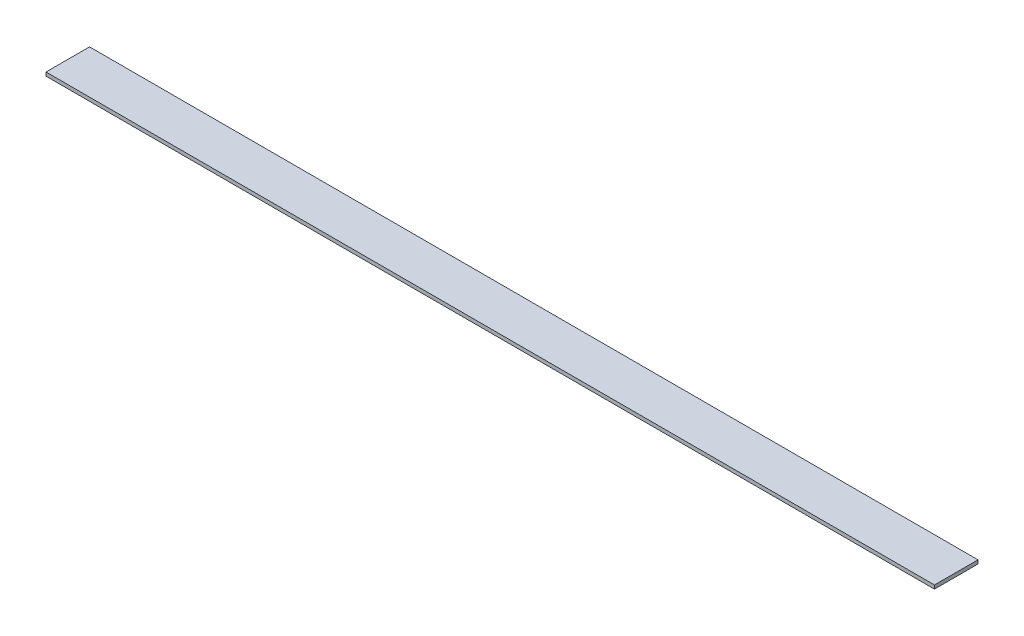
from build123d import *

# Parameters (mm, degrees)
SKETCH1_W               = 930
SKETCH1_H               = 555
SKETCH1_W_2             = 777.6
SKETCH1_H_2             = 478.8
BOSS_EXTRUDE2_DEPTH     = 3.175
CUT_EXTRUDE1_DEPTH      = 542.517618019
CUT_EXTRUDE1_DEPTH_BACK = 542.517618019


with BuildPart() as part:
    # Sketch1 → Boss-Extrude2 (new body)
    with BuildSketch(Plane(origin=(0, 0, 0), x_dir=(1, 0, 0), z_dir=(0, 1, 0))):
        Rectangle(SKETCH1_W, SKETCH1_H)
        Rectangle(SKETCH1_W_2, SKETCH1_H_2, mode=Mode.SUBTRACT)
    extrude(amount=BOSS_EXTRUDE2_DEPTH)

    # Sketch2 → Cut-Extrude1 (cut, two sides: drawn at the far end of the back side and taken through both)
    with BuildSketch(Plane(origin=(0, 3.175, 0), x_dir=(1, 0, 0), z_dir=(0, 1, 0)).offset(-CUT_EXTRUDE1_DEPTH_BACK)):
        Polygon((-465, 277.5), (-388.8, 277.5), (-388.8, -239.4), (388.8, -239.4), (388.8, 277.5), (465, 277.5), (465, -277.5), (414.2, -277.5), (-414.2, -277.5), (-465, -277.5), align=None)
    extrude(amount=CUT_EXTRUDE1_DEPTH + CUT_EXTRUDE1_DEPTH_BACK, mode=Mode.SUBTRACT)


solid = part.part
